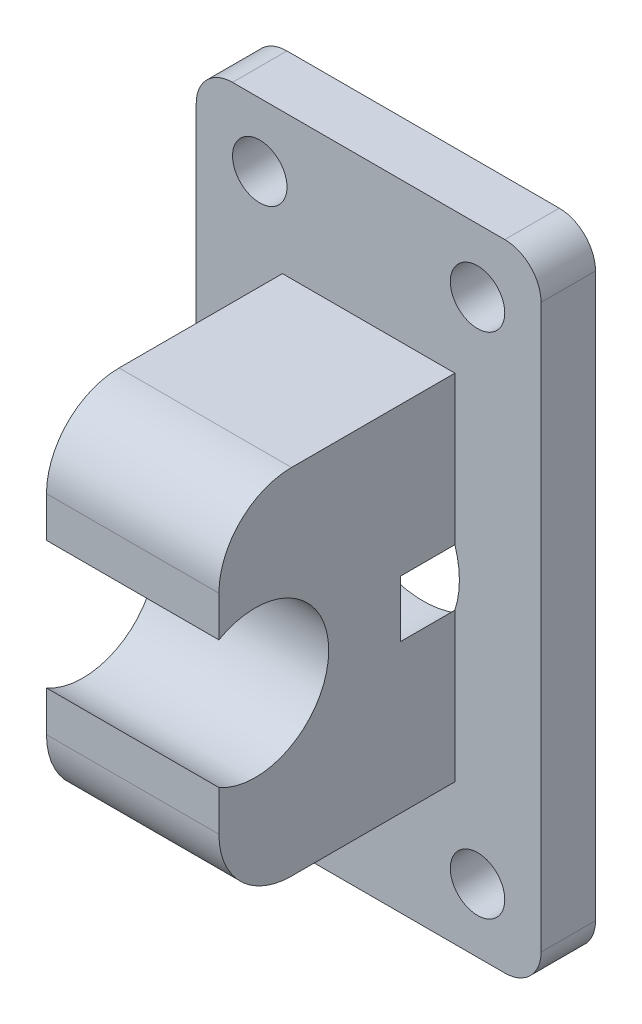
from build123d import *

# Parameters (mm, degrees)
SKETCH_1_W          = 19
SKETCH_1_H          = 35
SKETCH_1_R          = 1.5
EXTRUDE_1_DEPTH     = 3
SKETCH_2_W          = 9.5
SKETCH_2_H          = 19.5
EXTRUDE_2_DEPTH     = 16
SKETCH_3_R          = 4.05
CUT_EXTRUDE_1_DEPTH = 16
SKETCH_4_W          = 3
SKETCH_4_H          = 19.5
CUT_EXTRUDE_2_DEPTH = 16
FILLET_1_R          = 2
SKETCH_5_R          = 5
CUT_EXTRUDE_3_DEPTH = 6
FILLET_3_R          = 4


with BuildPart() as part:
    # 草图1 → 凸台-拉伸1 (new body)
    with BuildSketch(Plane.XY):
        Rectangle(SKETCH_1_W, SKETCH_1_H)
        with Locations((-6, 14)):
            Circle(SKETCH_1_R, mode=Mode.SUBTRACT)
        with Locations((6, 14)):
            Circle(SKETCH_1_R, mode=Mode.SUBTRACT)
        with Locations((6, -14)):
            Circle(SKETCH_1_R, mode=Mode.SUBTRACT)
        with Locations((-6, -14)):
            Circle(SKETCH_1_R, mode=Mode.SUBTRACT)
    extrude(amount=EXTRUDE_1_DEPTH)

    # 草图2 → 凸台-拉伸2 (add)
    with BuildSketch(Plane.XY.offset(3)):
        Rectangle(SKETCH_2_W, SKETCH_2_H)
    extrude(amount=EXTRUDE_2_DEPTH)

    # 草图3 → 切除-拉伸1 (cut)
    with BuildSketch(Plane.ZY.offset(4.75)):
        with Locations(Location((14, 0, 0), (0, 0, 270))):
            Circle(SKETCH_3_R)
    extrude(amount=-CUT_EXTRUDE_1_DEPTH, mode=Mode.SUBTRACT)

    # 草图4 → 切除-拉伸2 (cut)
    with BuildSketch(Plane.ZY.offset(4.75)):
        with Locations((17.5, 0)):
            Rectangle(SKETCH_4_W, SKETCH_4_H)
    extrude(amount=-CUT_EXTRUDE_2_DEPTH, mode=Mode.SUBTRACT)

    # 圆角1
    fillet_1_edges = [part.edges().sort_by_distance(p)[0] for p in [
        (9.5, -17.5, 1.5),
        (-9.5, -17.5, 1.5),
        (-9.5, 17.5, 1.5),
        (9.5, 17.5, 1.5),
    ]]
    fillet(fillet_1_edges, radius=FILLET_1_R)

    # 草图5 → 切除-拉伸3 (cut)
    with BuildSketch(Plane(origin=(0, 0, 0), x_dir=(-1, 0, 0), z_dir=(0, 0, -1))):
        Circle(SKETCH_5_R)
    extrude(amount=-CUT_EXTRUDE_3_DEPTH, mode=Mode.SUBTRACT)

    # 圆角3
    fillet_3_edges = [part.edges().sort_by_distance(p)[0] for p in [
        (0, 9.75, 16),
        (0, -9.75, 16),
    ]]
    fillet(fillet_3_edges, radius=FILLET_3_R)


solid = part.part
